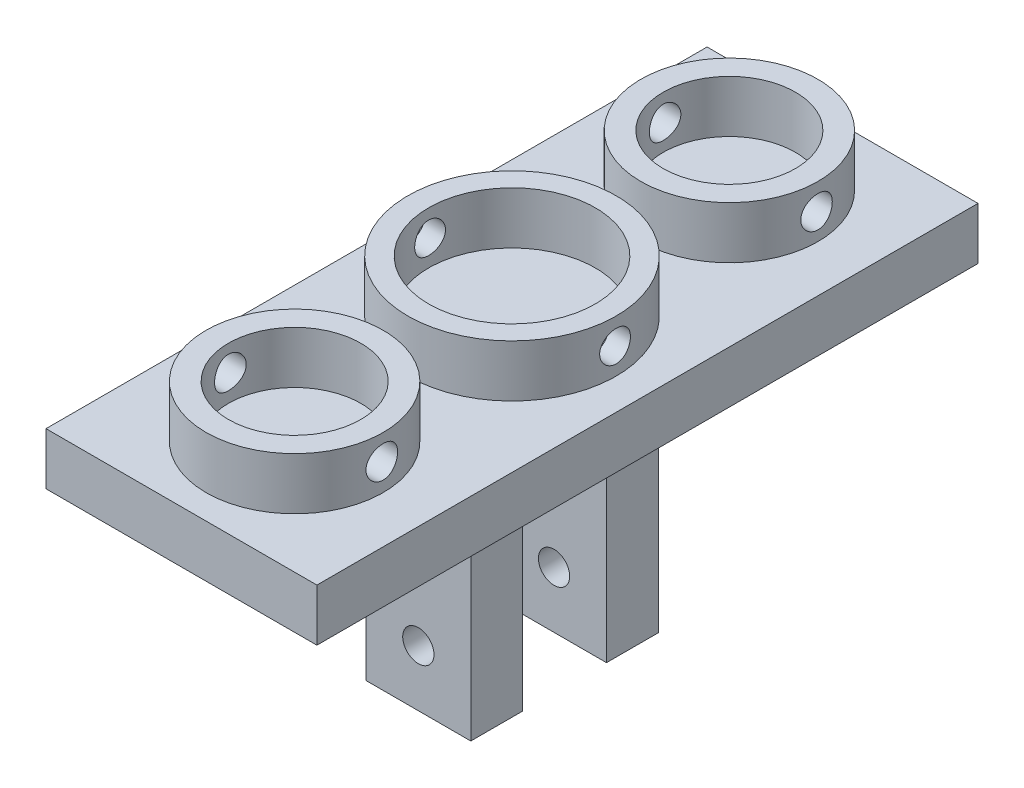
from build123d import *

# Parameters (mm, degrees)
CROQUIS1_W                 = 10.074318824
CROQUIS1_H                 = 23.311592876
CROQUIS1_R                 = 1.513350195
CROQUIS1_R_2               = 1.5
SALIENTE_EXTRUIR1_DEPTH    = 18
CROQUIS2_W                 = 10.074318824
CROQUIS2_H                 = 18
SALIENTE_EXTRUIR2_DEPTH    = 5
CORTAR_EXTRUIR1_DEPTH      = 22
SALIENTE_EXTRUIR3_DEPTH    = 5
CROQUIS5_R                 = 10
CROQUIS5_R_2               = 8
SALIENTE_EXTRUIR4_DEPTH    = 5
CORTAR_EXTRUIR3_DEPTH      = 33
CORTAR_EXTRUIR3_DEPTH_BACK = 14
CROQUIS7_R                 = 1.475964283
CROQUIS11_R                = 8.5
CROQUIS11_R_2              = 6.35
SALIENTE_EXTRUIR6_DEPTH    = 5
CROQUIS12_R                = 8.5
CROQUIS12_R_2              = 6.35
SALIENTE_EXTRUIR8_DEPTH    = 5
CORTAR_EXTRUIR4_DEPTH      = 22
CORTAR_EXTRUIR4_DEPTH_BACK = 14
CROQUIS13_R                = 1.510922734
CORTAR_EXTRUIR5_DEPTH      = 25
CORTAR_EXTRUIR5_DEPTH_BACK = 24
CROQUIS14_R                = 1.5177653


with BuildPart() as part:
    # Croquis1 → Saliente-Extruir1 (new body)
    with BuildSketch(Plane.XY):
        with Locations((-0.003103843, -6.255796438)):
            Rectangle(CROQUIS1_W, CROQUIS1_H)
        Circle(CROQUIS1_R, mode=Mode.SUBTRACT)
        with Locations((0, -12.5)):
            Circle(CROQUIS1_R_2, mode=Mode.SUBTRACT)
    extrude(amount=SALIENTE_EXTRUIR1_DEPTH)

    # Croquis2 → Saliente-Extruir2 (add)
    with BuildSketch(Plane(origin=(0, 5.4, 0), x_dir=(1, 0, 0), z_dir=(0, 1, 0))):
        with Locations((-0.003103843, -9)):
            Rectangle(CROQUIS2_W, CROQUIS2_H)
    extrude(amount=SALIENTE_EXTRUIR2_DEPTH)

    # Croquis3 → Cortar-Extruir1 (cut)
    with BuildSketch(Plane(origin=(5.034055569, 0, 0), x_dir=(0, 0, -1), z_dir=(1, 0, 0))):
        Polygon((-9, -17.911592876), (-13.015052671, -17.911592876), (-13.015052671, 5.408457803), (-4.97666887, 5.408457803), (-4.97666887, -17.911592876), align=None)
    extrude(amount=-CORTAR_EXTRUIR1_DEPTH, mode=Mode.SUBTRACT)

    # Croquis4 → Saliente-Extruir3 (add)
    with BuildSketch(Plane(origin=(0, 10.4, 0), x_dir=(1, 0, 0), z_dir=(0, 1, 0))):
        Polygon((-0.003103843, 22.715254114), (12.996896157, 22.715254114), (12.996896157, -40.731801261), (-13.003103843, -40.731801261), (-13.003103843, 22.715254114), align=None)
    extrude(amount=-SALIENTE_EXTRUIR3_DEPTH)

    # Croquis5 → Saliente-Extruir4 (add)
    with BuildSketch(Plane(origin=(0, 10.4, 0), x_dir=(1, 0, 0), z_dir=(0, 1, 0))):
        with Locations(Location((-0.003103843, -9.008273573, 0), (0, 0, 270))):
            Circle(CROQUIS5_R)
        with Locations(Location((-0.003103843, -9.008273573, 0), (0, 0, 270))):
            Circle(CROQUIS5_R_2, mode=Mode.SUBTRACT)
    extrude(amount=SALIENTE_EXTRUIR4_DEPTH)

    # Croquis7 → Cortar-Extruir3 (cut, two sides: drawn at the far end of the back side and taken through both)
    with BuildSketch(Plane(origin=(0, 0, 0), x_dir=(0, 0, -1), z_dir=(1, 0, 0)).offset(-CORTAR_EXTRUIR3_DEPTH_BACK)):
        with Locations(Location((-9.008273573, 12.900838069, 0), (0, 0, 180))):
            Circle(CROQUIS7_R)
    extrude(amount=CORTAR_EXTRUIR3_DEPTH + CORTAR_EXTRUIR3_DEPTH_BACK, mode=Mode.SUBTRACT)

    # Croquis11 → Saliente-Extruir6 (add)
    with BuildSketch(Plane(origin=(0, 10.4, 0), x_dir=(1, 0, 0), z_dir=(0, 1, 0))):
        with Locations(Location((-0.003103843, 11.85349027, 0), (0, 0, 270))):
            Circle(CROQUIS11_R)
        with Locations(Location((-0.003103843, 11.85349027, 0), (0, 0, 270))):
            Circle(CROQUIS11_R_2, mode=Mode.SUBTRACT)
    extrude(amount=SALIENTE_EXTRUIR6_DEPTH)

    # Croquis12 → Saliente-Extruir8 (add)
    with BuildSketch(Plane(origin=(0, 10.4, 0), x_dir=(1, 0, 0), z_dir=(0, 1, 0))):
        with Locations(Location((-0.003103843, -29.870037417, 0), (0, 0, 270))):
            Circle(CROQUIS12_R)
        with Locations(Location((-0.003103843, -29.870037417, 0), (0, 0, 270))):
            Circle(CROQUIS12_R_2, mode=Mode.SUBTRACT)
    extrude(amount=SALIENTE_EXTRUIR8_DEPTH)

    # Croquis13 → Cortar-Extruir4 (cut, two sides: drawn at the far end of the back side and taken through both)
    with BuildSketch(Plane(origin=(0, 0, 0), x_dir=(0, 0, -1), z_dir=(1, 0, 0)).offset(-CORTAR_EXTRUIR4_DEPTH_BACK)):
        with Locations(Location((11.85349027, 12.8884556, 0), (0, 0, 180))):
            Circle(CROQUIS13_R)
    extrude(amount=CORTAR_EXTRUIR4_DEPTH + CORTAR_EXTRUIR4_DEPTH_BACK, mode=Mode.SUBTRACT)

    # Croquis14 → Cortar-Extruir5 (cut, two sides: drawn at the far end of the back side and taken through both)
    with BuildSketch(Plane(origin=(0, 0, 0), x_dir=(0, 0, -1), z_dir=(1, 0, 0)).offset(-CORTAR_EXTRUIR5_DEPTH_BACK)):
        with Locations(Location((-29.870037417, 12.963711877, 0), (0, 0, 180))):
            Circle(CROQUIS14_R)
    extrude(amount=CORTAR_EXTRUIR5_DEPTH + CORTAR_EXTRUIR5_DEPTH_BACK, mode=Mode.SUBTRACT)


solid = part.part
